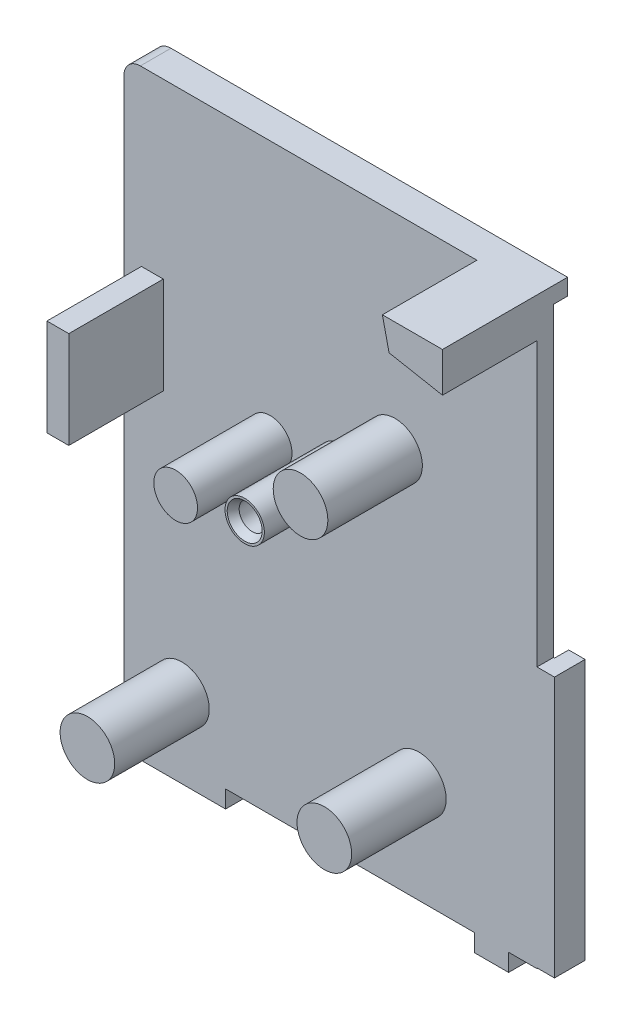
from build123d import *

# Parameters (mm, degrees)
DISPLAY_SUPPORT_PLATE_DEPTH           = 1.5
UNDERSIDE_LOCATING_RIM_START          = -1.3
UNDERSIDE_LOCATING_RIM_PROFILE_W      = 3.099998474
UNDERSIDE_LOCATING_RIM_PROFILE_H      = 1.499999911
UNDERSIDE_LOCATING_RIM_DEPTH          = 1.3
DISPLAY_RELIEF_PROFILE_W              = 17
DISPLAY_RELIEF_PROFILE_H              = 25
DISPLAY_RELIEF_DEPTH                  = 0.2
POSTS_AND_RETAINING_STOPS_PROFILE_R   = 2.500000022
POSTS_AND_RETAINING_STOPS_PROFILE_R_2 = 2.500000099
POSTS_AND_RETAINING_STOPS_PROFILE_W   = 2
POSTS_AND_RETAINING_STOPS_PROFILE_H   = 8.867599487
POSTS_AND_RETAINING_STOPS_DEPTH       = 8.65
LOCATING_POST_BORE_PROFILE_R          = 1.2
LOCATING_POST_BORE_DEPTH              = 8.65
BORE_ENTRY_CHAMFER_PROFILE_R          = 1.6
BORE_ENTRY_CHAMFER_DEPTH              = 0.692820323
BORE_ENTRY_CHAMFER_DRAFT              = -30


with BuildPart() as part:
    # Display_support_plate_profile → Display_support_plate (new body)
    with BuildSketch(Plane.XY):
        with BuildLine():
            Line((-0.099999994, 53.399997711), (36.200000763, 53.399997711))
            Line((36.200000763, 53.399997711), (36.200000763, 23.911094666))
            Line((36.200000763, 23.911094666), (37.799999237, 23.911094666))
            Line((37.799999237, 23.911094666), (37.799999237, 0.059999999))
            Line((37.799999237, 0.059999999), (36.200000763, 0.059999999))
            Line((36.200000763, 0.059999999), (36.200000763, 0))
            Line((36.200000763, 0), (33.599998474, 0))
            Line((33.599998474, 0), (33.599998474, -1.599999905))
            Line((33.599998474, -1.599999905), (30.5, -1.599999905))
            Line((30.5, -1.599999905), (30.5, 0))
            Line((30.5, 0), (7.699999809, 0))
            Line((7.699999809, 0), (7.699999809, -1.599999905))
            Line((7.699999809, -1.599999905), (-0.099999994, -1.599999905))
            ThreePointArc((-0.099999994, -1.599999905), (-1.160660136, -1.160660136), (-1.599999905, -0.099999994))
            Line((-1.599999905, -0.099999994), (-1.599999905, 51.899997711))
            ThreePointArc((-1.599999905, 51.899997711), (-1.160660627, 52.960658371), (-0.099999994, 53.399997711))
        make_face()
    extrude(amount=DISPLAY_SUPPORT_PLATE_DEPTH)

    # Underside_locating_rim_profile → Underside_locating_rim (add)
    with BuildSketch(Plane.XY.offset(UNDERSIDE_LOCATING_RIM_START)):
        with Locations((32.049999237, -0.84999995)):
            Rectangle(UNDERSIDE_LOCATING_RIM_PROFILE_W, UNDERSIDE_LOCATING_RIM_PROFILE_H)
        with BuildLine():
            Line((-0.099999994, -0.099999994), (7.699999809, -0.099999994))
            Line((7.699999809, -0.099999994), (7.699999809, -1.599999905))
            Line((7.699999809, -1.599999905), (-0.099999994, -1.599999905))
            ThreePointArc((-0.099999994, -1.599999905), (-1.160660103, -1.160660103), (-1.599999905, -0.099999994))
            Line((-1.599999905, -0.099999994), (-1.599999905, 4.496020254))
            Line((-1.599999905, 4.496020254), (-1.599999905, 51.899997711))
            ThreePointArc((-1.599999905, 51.899997711), (-1.160660627, 52.960658371), (-0.099999994, 53.399997711))
            Line((-0.099999994, 53.399997711), (36.200000763, 53.399997711))
            Line((36.200000763, 53.399997711), (36.200000763, 51.899997711))
            Line((36.200000763, 51.899997711), (-0.100001678, 51.899999485))
            Line((-0.100001678, 51.899999485), (-0.099999994, -0.099999994))
        make_face()
        Polygon((36.299999237, 23.911094665), (37.799999237, 23.911094665), (37.799999237, 22.93311111), (37.799999237, 0.059999999), (36.299999237, 0.059999999), align=None)
    extrude(amount=UNDERSIDE_LOCATING_RIM_DEPTH)

    # Display_relief_profile → Display_relief (cut)
    with BuildSketch(Plane.XY):
        with Locations((18.05, 25.9)):
            Rectangle(DISPLAY_RELIEF_PROFILE_W, DISPLAY_RELIEF_PROFILE_H)
    extrude(amount=DISPLAY_RELIEF_DEPTH, mode=Mode.SUBTRACT)

    # Posts_and_retaining_stops_profile → Posts_and_retaining_stops (add)
    with BuildSketch(Plane.XY.offset(1.5)):
        with Locations(Location((3.706309939, 5.563148769, 0), (0, 0, 180))):
            Circle(POSTS_AND_RETAINING_STOPS_PROFILE_R)
        with Locations(Location((25.3881588, 9.264928353, 0), (0, 0, 180))):
            Circle(POSTS_AND_RETAINING_STOPS_PROFILE_R_2)
        with Locations((1, 33.121494294)):
            Rectangle(POSTS_AND_RETAINING_STOPS_PROFILE_W, POSTS_AND_RETAINING_STOPS_PROFILE_H)
        with BuildLine():
            Line((21.687360763, 36.601463318), (21.626880424, 36.552923367))
            Line((21.626880424, 36.552923367), (21.602294922, 36.533191681))
            ThreePointArc((21.602294922, 36.533191681), (20.794438476, 35.265124808), (20.860019559, 33.763018036))
            ThreePointArc((20.860019559, 33.763018036), (25.609375503, 33.918488596), (21.687360763, 36.601463318))
        make_face()
        with BuildLine():
            Line((17.003135681, 32.186939239), (17.021439612, 32.20036124))
            Line((17.021439612, 32.20036124), (17.066467285, 32.233379364))
            ThreePointArc((17.066467285, 32.233379364), (19.77657842, 30.106586026), (16.341625109, 30.369355924))
            ThreePointArc((16.341625109, 30.369355924), (16.40750088, 31.374550646), (17.003135681, 32.186939239))
        make_face()
        with BuildLine():
            Line((9.829716682, 30.064435959), (9.817612885, 30.003588118))
            Line((9.817612885, 30.003588118), (9.812692642, 29.978853226))
            ThreePointArc((9.812692642, 29.978853226), (10.74475441, 27.921723152), (12.999830034, 28.044837762))
            ThreePointArc((12.999830034, 28.044837762), (12.856910571, 31.318323984), (9.829716682, 30.064435959))
        make_face()
        Polygon((36.200000763, 49.774204254), (36.200000763, 53.399997711), (32.290077446, 53.399997711), (30.700677872, 53.399997711), (31.313196182, 50.690540314), align=None)
    extrude(amount=POSTS_AND_RETAINING_STOPS_DEPTH)

    # Locating_post_bore_profile → Locating_post_bore (cut)
    with BuildSketch(Plane.XY.offset(10.15)):
        with Locations((18.098906, 30.758906)):
            Circle(LOCATING_POST_BORE_PROFILE_R)
    extrude(amount=-LOCATING_POST_BORE_DEPTH, mode=Mode.SUBTRACT)


with BuildPart() as bore_entry_chamfer_tool:
    # Bore_entry_chamfer_profile → Bore_entry_chamfer (with draft: the straight prism first)
    with BuildSketch(Plane.XY.offset(10.15)):
        with Locations((18.098906, 30.758906)):
            Circle(BORE_ENTRY_CHAMFER_PROFILE_R)
    extrude(amount=-BORE_ENTRY_CHAMFER_DEPTH)
    # Bore_entry_chamfer: the draft: its side faces are tilted about the plane it starts from
    bore_entry_chamfer_sides = [bore_entry_chamfer_tool.faces().sort_by_distance(p)[0] for p in [
        (16.498906, 30.758906, 9.803589838),
    ]]
    draft(bore_entry_chamfer_sides, Plane.XY.offset(10.15), BORE_ENTRY_CHAMFER_DRAFT)


with BuildPart() as part_1:
    add(part.part)

    # Bore_entry_chamfer: cut by bore_entry_chamfer_tool
    add(bore_entry_chamfer_tool.part, mode=Mode.SUBTRACT)


solid = part_1.part
